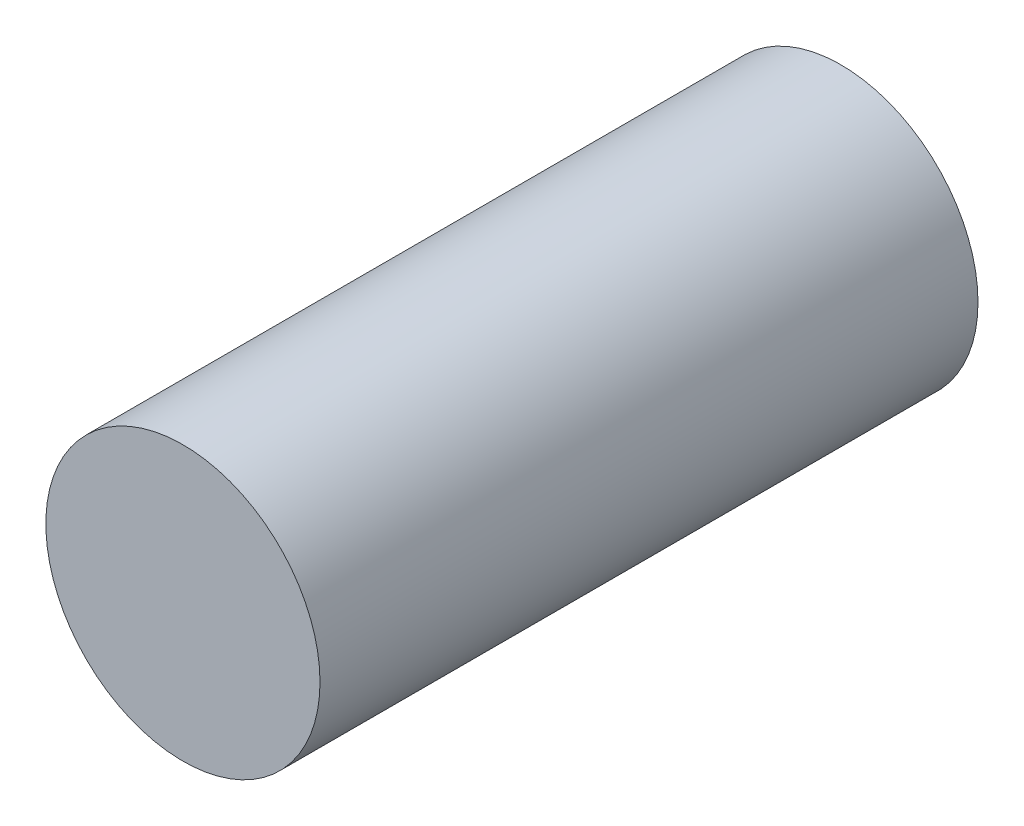
from build123d import *

# Parameters (mm, degrees)
SKETCH1_R           = 6.25
BOSS_EXTRUDE1_DEPTH = 15


with BuildPart() as part:
    # Sketch1 → Boss-Extrude1 (new, symmetric)
    with BuildSketch(Plane.XY):
        Circle(SKETCH1_R)
    extrude(amount=BOSS_EXTRUDE1_DEPTH, both=True)


solid = part.part
